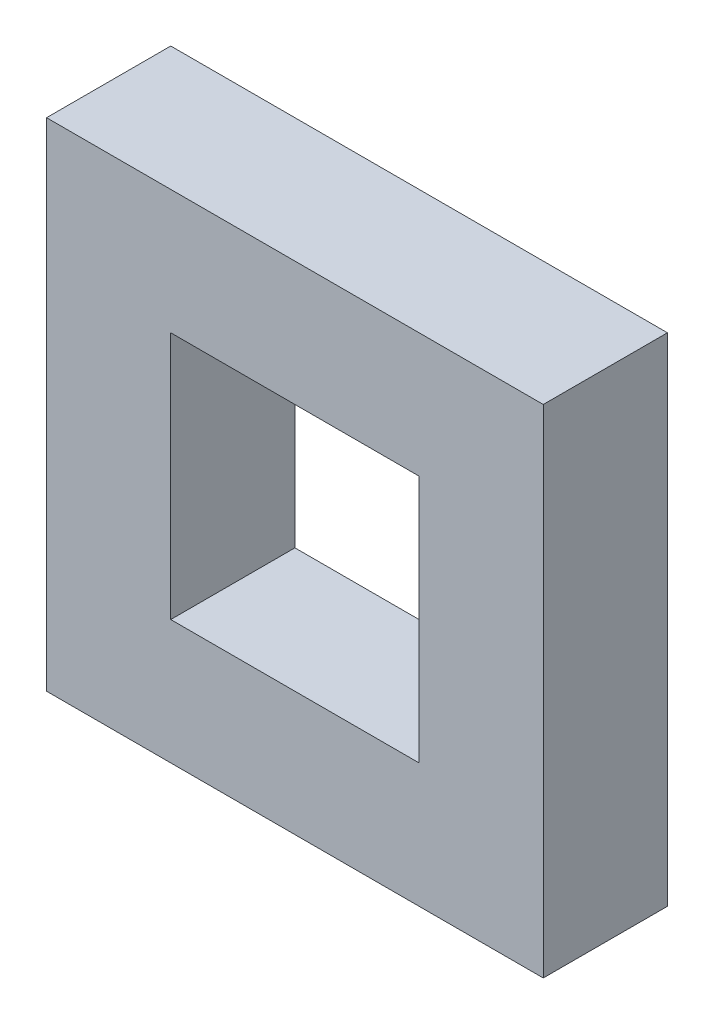
from build123d import *

# Parameters (mm, degrees)
SKETCH1_W           = 20
SKETCH1_H           = 20
BOSS_EXTRUDE1_DEPTH = 5
SKETCH2_W           = 10
SKETCH2_H           = 10
CUT_EXTRUDE1_DEPTH  = 29.722813233


with BuildPart() as part:
    # Sketch1 → Boss-Extrude1 (new body)
    with BuildSketch(Plane.XY):
        with Locations((10, 10)):
            Rectangle(SKETCH1_W, SKETCH1_H)
    extrude(amount=BOSS_EXTRUDE1_DEPTH)

    # Sketch2 → Cut-Extrude1 (cut, through all)
    with BuildSketch(Plane.XY.offset(5)):
        with Locations((10, 10)):
            Rectangle(SKETCH2_W, SKETCH2_H)
    extrude(amount=-CUT_EXTRUDE1_DEPTH, mode=Mode.SUBTRACT)


solid = part.part
